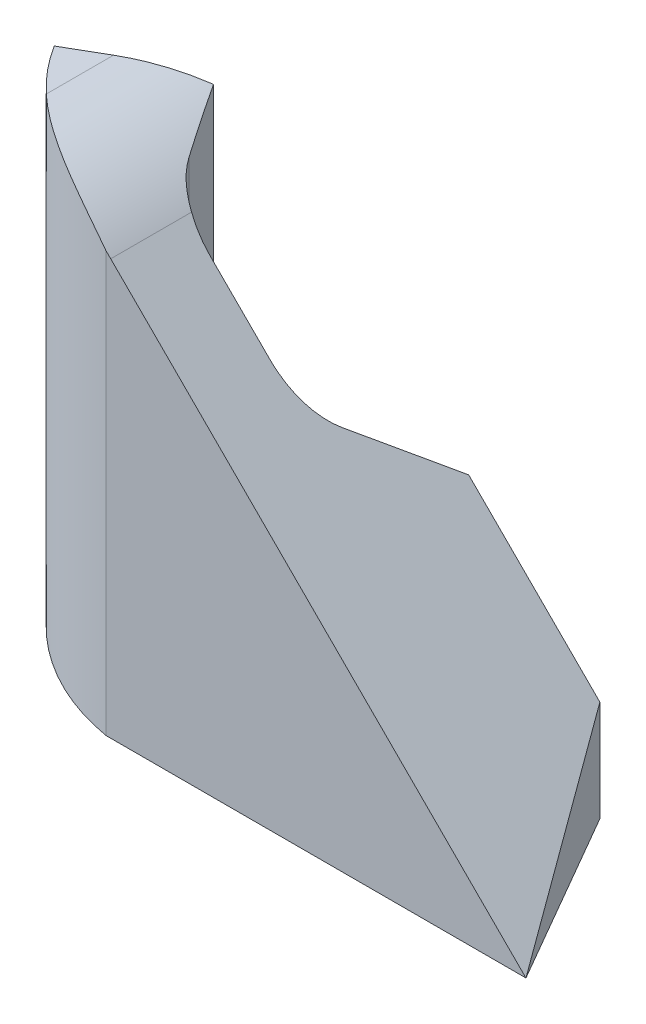
from build123d import *

# Parameters (mm, degrees)
BOSS_EXTRUDE1_DEPTH = 80
CUT_EXTRUDE1_DEPTH  = 60
FILLET1_R           = 30
FILLET3_R           = 10


with BuildPart() as part:
    # Sketch31 → Boss-Extrude1 (new body)
    with BuildSketch(Plane(origin=(0, 0, 0), x_dir=(1, 0, 0), z_dir=(0, 1, 0))):
        with BuildLine():
            Line((78, 0), (150, 0))
            Line((150, 0), (132.679491924, 30))
            Line((132.679491924, 30), (110.179491924, 30))
            Line((110.179491924, 30), (98.275963775, 13))
            Line((98.275963775, 13), (82.859757015, 13))
            ThreePointArc((82.859757015, 13), (77.860100275, 14.33954779), (74.199899362, 17.999313504))
            Line((74.199899362, 17.999313504), (68.440162758, 27.973643859))
            Line((68.440162758, 27.973643859), (51.120447452, 17.972270867))
            ThreePointArc((51.120447452, 17.972270867), (62.6510159, 6.130700387), (78, 0))
        make_face()
    extrude(amount=BOSS_EXTRUDE1_DEPTH)

    # Sketch32 → Cut-Extrude1 (cut)
    with BuildSketch(Plane.XY):
        Polygon((70, 80), (150, 0), (150, 80), align=None)
    extrude(amount=-CUT_EXTRUDE1_DEPTH, mode=Mode.SUBTRACT)

    # Fillet1
    fillet1_edges = [part.edges().sort_by_distance(p)[0] for p in [
        (70, 80, -13.766443848),
    ]]
    fillet(fillet1_edges, radius=FILLET1_R)

    # Fillet3
    fillet3_edges = [part.edges().sort_by_distance(p)[0] for p in [
        (98.275963775, 25.862018113, -13),
    ]]
    fillet(fillet3_edges, radius=FILLET3_R)


solid = part.part
